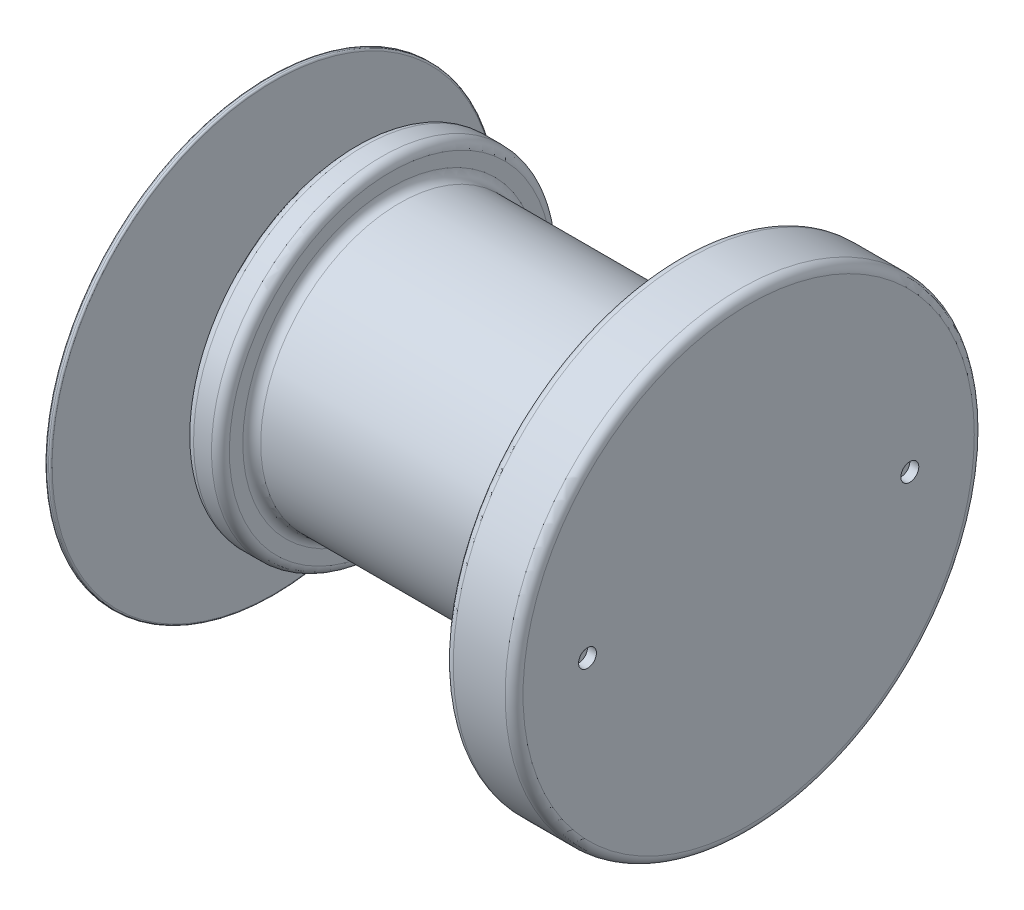
from build123d import *

# Parameters (mm, degrees)
SKETCH1_R           = 131
BOSS_EXTRUDE1_DEPTH = 39
SKETCH2_R           = 77.5
BOSS_EXTRUDE2_DEPTH = 181
SKETCH3_R           = 95
BOSS_EXTRUDE3_DEPTH = 20
SKETCH4_R           = 20
BOSS_EXTRUDE4_DEPTH = 45
SKETCH5_R           = 6
BOSS_EXTRUDE5_DEPTH = 22
SKETCH6_R           = 125
BOSS_EXTRUDE6_DEPTH = 3
SKETCH7_R           = 14
BOSS_EXTRUDE7_DEPTH = 10
SKETCH8_R           = 5
CUT_EXTRUDE1_DEPTH  = 5
FILLET1_R           = 1
FILLET2_R           = 1
FILLET3_R           = 5


with BuildPart() as part:
    # Sketch1 → Boss-Extrude1 (new body)
    with BuildSketch(Plane(origin=(0, 0, 0), x_dir=(0, -1, 0), z_dir=(1, 0, 0))):
        with Locations(Location((0, 0, 0), (0, 0, 90))):
            Circle(SKETCH1_R)
    extrude(amount=BOSS_EXTRUDE1_DEPTH)

    # Sketch2 → Boss-Extrude2 (add)
    with BuildSketch(Plane(origin=(0, 0, 0), x_dir=(0, -1, 0), z_dir=(-1, 0, 0))):
        with Locations(Location((0, 0, 0), (0, 0, 270))):
            Circle(SKETCH2_R)
    extrude(amount=BOSS_EXTRUDE2_DEPTH)



with BuildPart() as body_2:
    # Sketch3 → Boss-Extrude3 (new body)
    with BuildSketch(Plane(origin=(-181, 0, 0), x_dir=(0, -1, 0), z_dir=(-1, 0, 0))):
        Circle(SKETCH3_R)
    extrude(amount=-BOSS_EXTRUDE3_DEPTH)


with BuildPart() as part_1:
    add(part.part)

    add(body_2.part)  # Boss-Extrude4 merges body 2
    # Sketch4 → Boss-Extrude4 (add)
    with BuildSketch(Plane(origin=(-181, 0, 0), x_dir=(0, -1, 0), z_dir=(-1, 0, 0))):
        with Locations(Location((22.5, 0, 0), (0, 0, 180))):
            Circle(SKETCH4_R)
    extrude(amount=BOSS_EXTRUDE4_DEPTH)

    # Sketch5 → Boss-Extrude5 (add)
    with BuildSketch(Plane(origin=(-226, 0, 0), x_dir=(0, -1, 0), z_dir=(-1, 0, 0))):
        with Locations((22.5, 0)):
            Circle(SKETCH5_R)
    extrude(amount=BOSS_EXTRUDE5_DEPTH)

    # Sketch6 → Boss-Extrude6 (add)
    with BuildSketch(Plane(origin=(-226, 0, 0), x_dir=(0, -1, 0), z_dir=(-1, 0, 0))):
        with Locations((22.5, 0)):
            Circle(SKETCH6_R)
    extrude(amount=BOSS_EXTRUDE6_DEPTH)

    # Sketch7 → Boss-Extrude7 (add)
    with BuildSketch(Plane(origin=(-248, 0, 0), x_dir=(0, -1, 0), z_dir=(-1, 0, 0))):
        with Locations((22.5, 0)):
            Circle(SKETCH7_R)
    extrude(amount=-BOSS_EXTRUDE7_DEPTH)

    # Sketch8 → Cut-Extrude1 (cut)
    with BuildSketch(Plane(origin=(39, 0, 0), x_dir=(0, -1, 0), z_dir=(1, 0, 0))):
        with Locations(Location((0, 90, 0), (0, 0, 180))):
            Circle(SKETCH8_R)
        with Locations(Location((0, -90, 0), (0, 0, 180))):
            Circle(SKETCH8_R)
    extrude(amount=-CUT_EXTRUDE1_DEPTH, mode=Mode.SUBTRACT)

    # Fillet1
    fillet1_edges = [part_1.edges().sort_by_distance(p)[0] for p in [
        (-248, -8.5, 0),
        (-238, -8.5, 0),
    ]]
    fillet(fillet1_edges, radius=FILLET1_R)

    # Fillet2
    fillet2_edges = [part_1.edges().sort_by_distance(p)[0] for p in [
        (-229, 102.5, 0),
        (-226, 102.5, 0),
    ]]
    fillet(fillet2_edges, radius=FILLET2_R)

    # Fillet3
    fillet3_edges = [part_1.edges().sort_by_distance(p)[0] for p in [
        (-161, 0, 77.5),
        (-181, 95, 0),
        (-161, 95, 0),
        (0, 0, 131),
        (39, 0, 131),
        (0, 0, 77.5),
    ]]
    fillet(fillet3_edges, radius=FILLET3_R)


solid = part_1.part
